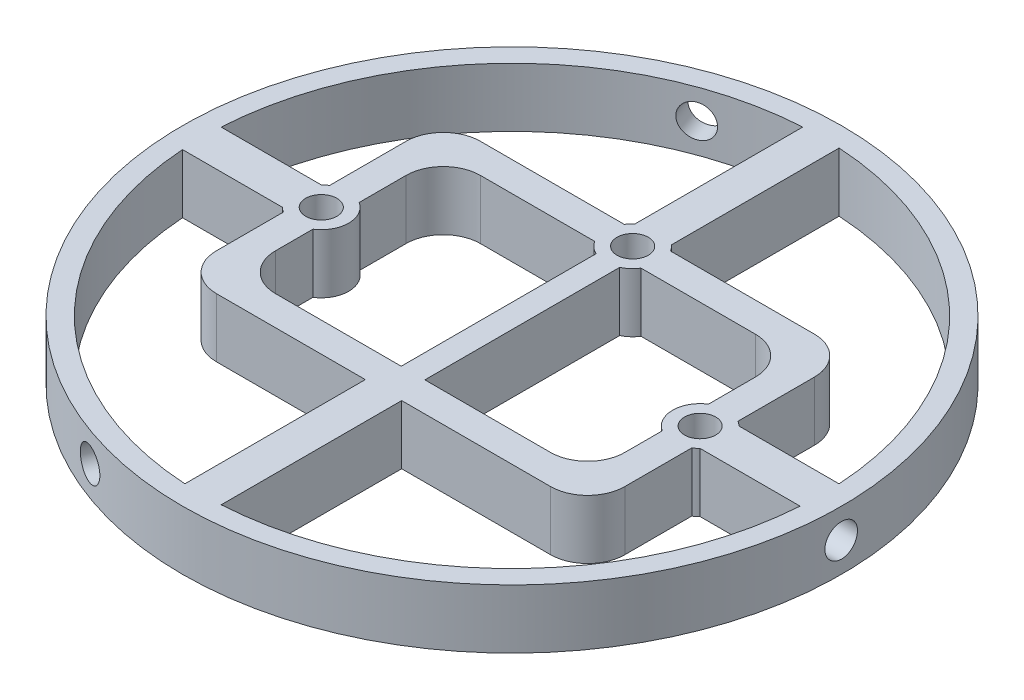
from build123d import *
from build123d.topology import SkipClean

# Parameters (mm, degrees)
SKETCH1_R                       = 37.719
BOSS_EXTRUDE2_DEPTH             = 6.35
SKETCH2_R                       = 1.68021
CUT_EXTRUDE1_DEPTH              = 6.35
CUT_EXTRUDE5_START              = -10
CUT_EXTRUDE5_DEPTH              = 10
BOSS_EXTRUDE3_DEPTH             = 6.35
BOSS_EXTRUDE4_START             = -6.35
BOSS_EXTRUDE4_DEPTH             = 6.35
CIRPATTERN3_COUNT               = 2
CIRPATTERN3_ANGLE               = 70
SKETCH13_R                      = 1.7526
CUT_EXTRUDE7_DEPTH              = 6.35
CIRPATTERN4_COUNT               = 2
CIRPATTERN4_ANGLE               = 140
CUT_EXTRUDE8_START              = -10.414
CUT_EXTRUDE8_DEPTH              = 10.414
CUT_EXTRUDE9_START              = 50.8
SKETCH16_R                      = 1.7526
CUT_EXTRUDE9_DEPTH              = 21.59
SKETCH17_R                      = 58.380414481
SKETCH17_R_2                    = 35.433
CUT_EXTRUDE10_DEPTH             = 18.796
BOSS_EXTRUDE5_START             = -6.35
SKETCH18_R                      = 34.941086643
SKETCH18_R_2                    = 33.274
BOSS_EXTRUDE5_DEPTH             = 6.35
CUT_EXTRUDE11_START             = 50.8
SKETCH19_R                      = 1.7526
CUT_EXTRUDE11_DEPTH             = 22.86
CIRPATTERN6_COUNT               = 2
CIRPATTERN6_ANGLE               = 110
CIRPATTERN6_THE_OTHER_WAY_COUNT = 2
CIRPATTERN6_THE_OTHER_WAY_ANGLE = 110
CIRPATTERN7_COUNT               = 2


with BuildPart() as part:
    # Sketch1 → Boss-Extrude2 (new body)
    # profile 1 of 2: a face of its own
    with BuildSketch(Plane(origin=(0, 0, 0), x_dir=(1, 0, 0), z_dir=(0, 1, 0))):
        with Locations(Location((0, 0, 0), (0, 0, 270))):
            Circle(SKETCH1_R)
        with BuildLine():
            ThreePointArc((-34.011603621, -4.360609948), (-34.289708145, -0.141475536), (-34.046427859, 4.079810052))
            ThreePointArc((-34.046427859, 4.079810052), (-24.295799022, 24.197484371), (-4.217826514, 34.029605339))
            ThreePointArc((-4.217826514, 34.029605339), (0, 34.29), (4.217826514, 34.029605339))
            ThreePointArc((4.217826514, 34.029605339), (24.295799022, 24.197484371), (34.046427859, 4.079810052))
            ThreePointArc((34.046427859, 4.079810052), (34.229052801, 2.043537218), (34.29, 0))
            ThreePointArc((34.29, 0), (34.220330128, -2.184743902), (34.011603621, -4.360609948))
            ThreePointArc((34.011603621, -4.360609948), (24.195756942, -24.297519339), (4.217826514, -34.029605339))
            ThreePointArc((4.217826514, -34.029605339), (0, -34.29), (-4.217826514, -34.029605339))
            ThreePointArc((-4.217826514, -34.029605339), (-24.195756942, -24.297519339), (-34.011603621, -4.360609948))
        make_face(mode=Mode.SUBTRACT)
    # profile 2 of 2: a face of its own
    with BuildSketch(Plane(origin=(0, 0, 0), x_dir=(1, 0, 0), z_dir=(0, 1, 0))):
        with BuildLine():
            Line((-23.22349651, 10.122441588), (-23.22349651, 4.079810052))
            Line((-23.22349651, 4.079810052), (-34.046427859, 4.079810052))
            ThreePointArc((-34.046427859, 4.079810052), (-34.289708145, -0.141475536), (-34.011603621, -4.360609948))
            Line((-34.011603621, -4.360609948), (-23.22349651, -4.360609948))
            Line((-23.22349651, -4.360609948), (-23.22349651, -10.403241484))
            ThreePointArc((-23.22349651, -10.403241484), (-21.759030416, -13.93877539), (-18.22349651, -15.403241484))
            Line((-18.22349651, -15.403241484), (-4.217826514, -15.403241484))
            Line((-4.217826514, -15.403241484), (-4.217826514, -34.029605339))
            ThreePointArc((-4.217826514, -34.029605339), (0, -34.29), (4.217826514, -34.029605339))
            Line((4.217826514, -34.029605339), (4.217826514, -15.403241484))
            Line((4.217826514, -15.403241484), (18.22349651, -15.403241484))
            ThreePointArc((18.22349651, -15.403241484), (21.759030416, -13.93877539), (23.22349651, -10.403241484))
            Line((23.22349651, -10.403241484), (23.22349651, -4.360609948))
            Line((23.22349651, -4.360609948), (34.011603621, -4.360609948))
            ThreePointArc((34.011603621, -4.360609948), (34.220330128, -2.184743902), (34.29, 0))
            ThreePointArc((34.29, 0), (34.229052801, 2.043537218), (34.046427859, 4.079810052))
            Line((34.046427859, 4.079810052), (23.22349651, 4.079810052))
            Line((23.22349651, 4.079810052), (23.22349651, 10.122441588))
            ThreePointArc((23.22349651, 10.122441588), (21.759030416, 13.657975493), (18.22349651, 15.122441588))
            Line((18.22349651, 15.122441588), (4.217826514, 15.122441588))
            Line((4.217826514, 15.122441588), (4.217826514, 34.029605339))
            ThreePointArc((4.217826514, 34.029605339), (0, 34.29), (-4.217826514, 34.029605339))
            Line((-4.217826514, 34.029605339), (-4.217826514, 15.122441588))
            Line((-4.217826514, 15.122441588), (-18.22349651, 15.122441588))
            ThreePointArc((-18.22349651, 15.122441588), (-21.759030416, 13.657975493), (-23.22349651, 10.122441588))
        make_face()
        with BuildLine():
            Line((-14.87349651, 8.772441588), (-4.217826514, 8.772441588))
            Line((-4.217826514, 8.772441588), (-4.217826514, -9.053241484))
            Line((-4.217826514, -9.053241484), (-14.87349651, -9.053241484))
            ThreePointArc((-14.87349651, -9.053241484), (-16.287710073, -8.467455047), (-16.87349651, -7.053241484))
            Line((-16.87349651, -7.053241484), (-16.87349651, -4.360609948))
            Line((-16.87349651, -4.360609948), (-16.87349651, 4.079810052))
            Line((-16.87349651, 4.079810052), (-16.87349651, 6.772441588))
            ThreePointArc((-16.87349651, 6.772441588), (-16.287710073, 8.18665515), (-14.87349651, 8.772441588))
        make_face(mode=Mode.SUBTRACT)
        with BuildLine():
            Line((16.87349651, 4.079810052), (16.87349651, -4.360609948))
            Line((16.87349651, -4.360609948), (16.87349651, -7.053241484))
            ThreePointArc((16.87349651, -7.053241484), (16.287710073, -8.467455047), (14.87349651, -9.053241484))
            Line((14.87349651, -9.053241484), (4.217826514, -9.053241484))
            Line((4.217826514, -9.053241484), (4.217826514, 8.772441588))
            Line((4.217826514, 8.772441588), (14.87349651, 8.772441588))
            ThreePointArc((14.87349651, 8.772441588), (16.287710073, 8.18665515), (16.87349651, 6.772441588))
            Line((16.87349651, 6.772441588), (16.87349651, 4.079810052))
        make_face(mode=Mode.SUBTRACT)
    extrude(amount=BOSS_EXTRUDE2_DEPTH)

    # Sketch2 → Cut-Extrude1 (cut)
    with BuildSketch(Plane(origin=(0, 6.35, 0), x_dir=(1, 0, 0), z_dir=(0, 1, 0))):
        with Locations(Location((-20.36599651, -0.140399948, 0), (0, 0, 270))):
            Circle(SKETCH2_R)
        with Locations(Location((0, 12.972585267, 0), (0, 0, 270))):
            Circle(SKETCH2_R)
        with Locations(Location((20.36599651, -0.140399948, 0), (0, 0, 270))):
            Circle(SKETCH2_R)
    extrude(amount=-CUT_EXTRUDE1_DEPTH, mode=Mode.SUBTRACT)

    # Sketch7 → Cut-Extrude5 (cut)
    # profile 1 of 6: a face of its own
    with SkipClean():  # the faces are left unmerged after this step: merging them gives an invalid solid
        with BuildSketch(Plane(origin=(0, 6.35, 0), x_dir=(1, 0, 0), z_dir=(0, 1, 0)).offset(CUT_EXTRUDE5_START)):
            with BuildLine():
                Line((-2.95021, 14.560085267), (-2.48668108, 14.560085267))
                ThreePointArc((-2.48668108, 14.560085267), (-1.953782114, 15.183122418), (-1.27, 15.635448209))
                Line((-1.27, 15.635448209), (-1.27, 34.266473411))
                ThreePointArc((-1.27, 34.266473411), (-2.74646802, 34.179833432), (-4.217826514, 34.029605339))
                Line((-4.217826514, 34.029605339), (-4.217826514, 15.122441588))
                Line((-4.217826514, 15.122441588), (-18.22349651, 15.122441588))
                ThreePointArc((-18.22349651, 15.122441588), (-21.759030416, 13.657975493), (-23.22349651, 10.122441588))
                Line((-23.22349651, 10.122441588), (-23.22349651, 4.079810052))
                Line((-23.22349651, 4.079810052), (-34.046427859, 4.079810052))
                ThreePointArc((-34.046427859, 4.079810052), (-34.178298252, 2.765506927), (-34.259451272, 1.447100052))
                Line((-34.259451272, 1.447100052), (-22.85267759, 1.447100052))
                ThreePointArc((-22.85267759, 1.447100052), (-22.452110007, 1.945713548), (-21.95349651, 2.346281132))
                Line((-21.95349651, 2.346281132), (-21.95349651, 10.560085267))
                ThreePointArc((-21.95349651, 10.560085267), (-20.781923635, 13.388512392), (-17.95349651, 14.560085267))
                Line((-17.95349651, 14.560085267), (-2.95021, 14.560085267))
            make_face()
        # profile 2 of 6: a face of its own
        with BuildSketch(Plane(origin=(0, 6.35, 0), x_dir=(1, 0, 0), z_dir=(0, 1, 0)).offset(CUT_EXTRUDE5_START)):
            with BuildLine():
                Line((21.95349651, 10.560085267), (21.95349651, 2.346281132))
                ThreePointArc((21.95349651, 2.346281132), (22.452110007, 1.945713548), (22.85267759, 1.447100052))
                Line((22.85267759, 1.447100052), (34.259451272, 1.447100052))
                ThreePointArc((34.259451272, 1.447100052), (34.178298252, 2.765506927), (34.046427859, 4.079810052))
                Line((34.046427859, 4.079810052), (23.22349651, 4.079810052))
                Line((23.22349651, 4.079810052), (23.22349651, 10.122441588))
                ThreePointArc((23.22349651, 10.122441588), (21.759030416, 13.657975493), (18.22349651, 15.122441588))
                Line((18.22349651, 15.122441588), (4.217826514, 15.122441588))
                Line((4.217826514, 15.122441588), (4.217826514, 34.029605339))
                ThreePointArc((4.217826514, 34.029605339), (2.74646802, 34.179833432), (1.27, 34.266473411))
                Line((1.27, 34.266473411), (1.27, 15.635448209))
                ThreePointArc((1.27, 15.635448209), (1.953782114, 15.183122418), (2.48668108, 14.560085267))
                Line((2.48668108, 14.560085267), (17.95349651, 14.560085267))
                ThreePointArc((17.95349651, 14.560085267), (20.781923635, 13.388512392), (21.95349651, 10.560085267))
            make_face()
        # profile 3 of 6: a face of its own
        with BuildSketch(Plane(origin=(0, 6.35, 0), x_dir=(1, 0, 0), z_dir=(0, 1, 0)).offset(CUT_EXTRUDE5_START)):
            with BuildLine():
                ThreePointArc((22.85267759, -1.727899948), (22.452110007, -2.226513445), (21.95349651, -2.627081029))
                Line((21.95349651, -2.627081029), (21.95349651, -9.815741484))
                ThreePointArc((21.95349651, -9.815741484), (20.781923635, -12.644168609), (17.95349651, -13.815741484))
                Line((17.95349651, -13.815741484), (4.217826514, -13.815741484))
                Line((4.217826514, -13.815741484), (1.27, -13.815741484))
                Line((1.27, -13.815741484), (1.27, -34.266473411))
                ThreePointArc((1.27, -34.266473411), (2.74646802, -34.179833432), (4.217826514, -34.029605339))
                Line((4.217826514, -34.029605339), (4.217826514, -15.403241484))
                Line((4.217826514, -15.403241484), (18.22349651, -15.403241484))
                ThreePointArc((18.22349651, -15.403241484), (21.759030416, -13.93877539), (23.22349651, -10.403241484))
                Line((23.22349651, -10.403241484), (23.22349651, -4.360609948))
                Line((23.22349651, -4.360609948), (34.011603621, -4.360609948))
                ThreePointArc((34.011603621, -4.360609948), (34.154396863, -3.046518488), (34.246437213, -1.727899948))
                Line((34.246437213, -1.727899948), (22.85267759, -1.727899948))
            make_face()
        # profile 4 of 6: a face of its own
        with BuildSketch(Plane(origin=(0, 6.35, 0), x_dir=(1, 0, 0), z_dir=(0, 1, 0)).offset(CUT_EXTRUDE5_START)):
            with BuildLine():
                Line((-1.27, -34.266473411), (-1.27, -13.815741484))
                Line((-1.27, -13.815741484), (-17.95349651, -13.815741484))
                ThreePointArc((-17.95349651, -13.815741484), (-20.781923635, -12.644168609), (-21.95349651, -9.815741484))
                Line((-21.95349651, -9.815741484), (-21.95349651, -2.627081029))
                ThreePointArc((-21.95349651, -2.627081029), (-22.452110007, -2.226513445), (-22.85267759, -1.727899948))
                Line((-22.85267759, -1.727899948), (-34.246437213, -1.727899948))
                ThreePointArc((-34.246437213, -1.727899948), (-34.154396863, -3.046518488), (-34.011603621, -4.360609948))
                Line((-34.011603621, -4.360609948), (-23.22349651, -4.360609948))
                Line((-23.22349651, -4.360609948), (-23.22349651, -10.403241484))
                ThreePointArc((-23.22349651, -10.403241484), (-21.759030416, -13.93877539), (-18.22349651, -15.403241484))
                Line((-18.22349651, -15.403241484), (-4.217826514, -15.403241484))
                Line((-4.217826514, -15.403241484), (-4.217826514, -34.029605339))
                ThreePointArc((-4.217826514, -34.029605339), (-2.74646802, -34.179833432), (-1.27, -34.266473411))
            make_face()
        # profile 5 of 6: a face of its own
        with BuildSketch(Plane(origin=(0, 6.35, 0), x_dir=(1, 0, 0), z_dir=(0, 1, 0)).offset(CUT_EXTRUDE5_START)):
            with BuildLine():
                Line((-1.27, -10.640741484), (-1.27, 10.309722326))
                ThreePointArc((-1.27, 10.309722326), (-1.953782114, 10.762048116), (-2.48668108, 11.385085267))
                Line((-2.48668108, 11.385085267), (-2.95021, 11.385085267))
                Line((-2.95021, 11.385085267), (-14.77849651, 11.385085267))
                ThreePointArc((-14.77849651, 11.385085267), (-17.606923635, 10.213512392), (-18.77849651, 7.385085267))
                Line((-18.77849651, 7.385085267), (-18.77849651, 2.346281132))
                ThreePointArc((-18.77849651, 2.346281132), (-17.778797502, 1.277394231), (-17.41578651, -0.140399948))
                ThreePointArc((-17.41578651, -0.140399948), (-17.778797502, -1.558194128), (-18.77849651, -2.627081029))
                Line((-18.77849651, -2.627081029), (-18.77849651, -6.640741484))
                ThreePointArc((-18.77849651, -6.640741484), (-17.606923635, -9.469168609), (-14.77849651, -10.640741484))
                Line((-14.77849651, -10.640741484), (-1.27, -10.640741484))
            make_face()
            with BuildLine():
                Line((-4.217826514, -9.053241484), (-14.87349651, -9.053241484))
                ThreePointArc((-14.87349651, -9.053241484), (-16.287710073, -8.467455047), (-16.87349651, -7.053241484))
                Line((-16.87349651, -7.053241484), (-16.87349651, 6.772441588))
                ThreePointArc((-16.87349651, 6.772441588), (-16.287710073, 8.18665515), (-14.87349651, 8.772441588))
                Line((-14.87349651, 8.772441588), (-4.217826514, 8.772441588))
                Line((-4.217826514, 8.772441588), (-4.217826514, -9.053241484))
            make_face(mode=Mode.SUBTRACT)
        # profile 6 of 6: a face of its own
        with BuildSketch(Plane(origin=(0, 6.35, 0), x_dir=(1, 0, 0), z_dir=(0, 1, 0)).offset(CUT_EXTRUDE5_START)):
            with BuildLine():
                Line((18.77849651, 2.346281132), (18.77849651, 7.385085267))
                ThreePointArc((18.77849651, 7.385085267), (17.606923635, 10.213512392), (14.77849651, 11.385085267))
                Line((14.77849651, 11.385085267), (2.48668108, 11.385085267))
                ThreePointArc((2.48668108, 11.385085267), (1.953782114, 10.762048116), (1.27, 10.309722326))
                Line((1.27, 10.309722326), (1.27, -10.640741484))
                Line((1.27, -10.640741484), (4.217826514, -10.640741484))
                Line((4.217826514, -10.640741484), (14.77849651, -10.640741484))
                ThreePointArc((14.77849651, -10.640741484), (17.606923635, -9.469168609), (18.77849651, -6.640741484))
                Line((18.77849651, -6.640741484), (18.77849651, -2.627081029))
                ThreePointArc((18.77849651, -2.627081029), (17.41578651, -0.140399948), (18.77849651, 2.346281132))
            make_face()
            with BuildLine():
                Line((4.217826514, 8.772441588), (14.87349651, 8.772441588))
                ThreePointArc((14.87349651, 8.772441588), (16.287710073, 8.18665515), (16.87349651, 6.772441588))
                Line((16.87349651, 6.772441588), (16.87349651, -7.053241484))
                ThreePointArc((16.87349651, -7.053241484), (16.287710073, -8.467455047), (14.87349651, -9.053241484))
                Line((14.87349651, -9.053241484), (4.217826514, -9.053241484))
                Line((4.217826514, -9.053241484), (4.217826514, 8.772441588))
            make_face(mode=Mode.SUBTRACT)
        extrude(amount=CUT_EXTRUDE5_DEPTH, mode=Mode.SUBTRACT)

    # Sketch8 → Boss-Extrude3 (add)
    with SkipClean():  # the faces are left unmerged after this step: merging them gives an invalid solid
        with BuildSketch(Plane.XZ):
            with BuildLine():
                ThreePointArc((-34.155457873, -3.034600052), (-34.28971008, 0.141005708), (-34.129345484, 3.315399948))
                Line((-34.129345484, 3.315399948), (-37.318016402, 3.315399948))
                ThreePointArc((-37.318016402, 3.315399948), (-37.464735022, 0.140906853), (-37.341899088, -3.034600052))
                Line((-37.341899088, -3.034600052), (-34.155457873, -3.034600052))
            make_face()
            with BuildLine():
                Line((-37.318016402, 3.315399948), (-34.129345484, 3.315399948))
                ThreePointArc((-34.129345484, 3.315399948), (1.659645044, 34.249812822), (34.29, 0))
                ThreePointArc((34.29, 0), (1.51879056, -34.256347955), (-34.155457873, -3.034600052))
                Line((-34.155457873, -3.034600052), (-37.341899088, -3.034600052))
                ThreePointArc((-37.341899088, -3.034600052), (1.518547934, -37.434212122), (37.465, 0))
                ThreePointArc((37.465, 0), (1.659328252, 37.428236063), (-37.318016402, 3.315399948))
            make_face()
        boss_extrude3 = extrude(amount=-BOSS_EXTRUDE3_DEPTH)

    # Sketch10 → Boss-Extrude4 (add)
    with SkipClean():  # the faces are left unmerged after this step: merging them gives an invalid solid
        with BuildSketch(Plane(origin=(0, 6.35, 0), x_dir=(1, 0, 0), z_dir=(0, 1, 0)).offset(BOSS_EXTRUDE4_START)):
            with BuildLine():
                ThreePointArc((1.27, 15.635448209), (1.627680077, 15.433153618), (1.953782114, 15.183122418))
                Line((1.953782114, 15.183122418), (1.953782114, 34.234293266))
                ThreePointArc((1.953782114, 34.234293266), (1.611971361, 34.252089693), (1.27, 34.266473411))
                Line((1.27, 34.266473411), (1.27, 15.635448209))
            make_face()
            with BuildLine():
                Line((-1.953782114, 34.234293266), (-1.953782114, 15.183122418))
                ThreePointArc((-1.953782114, 15.183122418), (-1.627680077, 15.433153618), (-1.27, 15.635448209))
                Line((-1.27, 15.635448209), (-1.27, 34.266473411))
                ThreePointArc((-1.27, 34.266473411), (-1.611971361, 34.252089693), (-1.953782114, 34.234293266))
            make_face()
            with BuildLine():
                ThreePointArc((34.259451272, 1.447100052), (34.248009453, 1.696451748), (34.234752793, 1.945713548))
                Line((34.234752793, 1.945713548), (22.452110007, 1.945713548))
                ThreePointArc((22.452110007, 1.945713548), (22.66594573, 1.707293919), (22.85267759, 1.447100052))
                Line((22.85267759, 1.447100052), (34.259451272, 1.447100052))
            make_face()
            with BuildLine():
                Line((-22.452110007, 1.945713548), (-34.234752793, 1.945713548))
                ThreePointArc((-34.234752793, 1.945713548), (-34.248009453, 1.696451748), (-34.259451272, 1.447100052))
                Line((-34.259451272, 1.447100052), (-22.85267759, 1.447100052))
                ThreePointArc((-22.85267759, 1.447100052), (-22.66594573, 1.707293919), (-22.452110007, 1.945713548))
            make_face()
            with BuildLine():
                ThreePointArc((22.85267759, -1.727899948), (22.66594573, -1.988093816), (22.452110007, -2.226513445))
                Line((22.452110007, -2.226513445), (34.217637818, -2.226513445))
                ThreePointArc((34.217637818, -2.226513445), (34.232945335, -1.977259132), (34.246437213, -1.727899948))
                Line((34.246437213, -1.727899948), (22.85267759, -1.727899948))
            make_face()
            with BuildLine():
                Line((-34.217637818, -2.226513445), (-22.452110007, -2.226513445))
                ThreePointArc((-22.452110007, -2.226513445), (-22.66594573, -1.988093816), (-22.85267759, -1.727899948))
                Line((-22.85267759, -1.727899948), (-34.246437213, -1.727899948))
                ThreePointArc((-34.246437213, -1.727899948), (-34.232945335, -1.977259132), (-34.217637818, -2.226513445))
            make_face()
            with BuildLine():
                Line((1.953782114, -34.234293266), (1.953782114, -13.815741484))
                Line((1.953782114, -13.815741484), (1.27, -13.815741484))
                Line((1.27, -13.815741484), (1.27, -34.266473411))
                ThreePointArc((1.27, -34.266473411), (1.611971361, -34.252089693), (1.953782114, -34.234293266))
            make_face()
            with BuildLine():
                Line((-1.27, -13.815741484), (-1.953782114, -13.815741484))
                Line((-1.953782114, -13.815741484), (-1.953782114, -34.234293266))
                ThreePointArc((-1.953782114, -34.234293266), (-1.611971361, -34.252089693), (-1.27, -34.266473411))
                Line((-1.27, -34.266473411), (-1.27, -13.815741484))
            make_face()
        extrude(amount=BOSS_EXTRUDE4_DEPTH)

    # CirPattern3: Boss-Extrude3 ×2 about axis
    with SkipClean():  # the faces are left unmerged after this step: merging them gives an invalid solid
        cirpattern3_axis = Axis((0, 0, 0), (0, -1, 0))
        for i in range(1, CIRPATTERN3_COUNT):
            add(boss_extrude3.rotate(cirpattern3_axis, i * CIRPATTERN3_ANGLE / (CIRPATTERN3_COUNT - 1)))

    # Sketch13 → Cut-Extrude7 (cut)
    with SkipClean():  # the faces are left unmerged after this step: merging them gives an invalid solid
        with BuildSketch(Plane(origin=(-12.900657786, 6.35, -35.444265963), x_dir=(-0.9396926207859082, 0, 0.34202014332566943), z_dir=(-0.34202014332566943, 0, -0.9396926207859082))):
            with Locations((0, -3.175)):
                Circle(SKETCH13_R)
        cut_extrude7 = extrude(amount=-CUT_EXTRUDE7_DEPTH, mode=Mode.SUBTRACT)

    # CirPattern4: Cut-Extrude7 ×2 about axis
    with SkipClean():  # the faces are left unmerged after this step: merging them gives an invalid solid
        cirpattern4_axis = Axis((0, 0, 0), (0, 1, 0))
        for i in range(1, CIRPATTERN4_COUNT):
            add(cut_extrude7.rotate(cirpattern4_axis, i * CIRPATTERN4_ANGLE / (CIRPATTERN4_COUNT - 1)), mode=Mode.SUBTRACT)

    # Sketch14 → Cut-Extrude8 (cut)
    with BuildSketch(Plane(origin=(0, 6.35, 0), x_dir=(1, 0, 0), z_dir=(0, 1, 0)).offset(CUT_EXTRUDE8_START)):
        with BuildLine():
            Line((-34.886870518, 1.945713548), (-34.234752793, 1.945713548))
            ThreePointArc((-34.234752793, 1.945713548), (-24.24954865, 24.243834067), (-1.953782114, 34.234293266))
            Line((-1.953782114, 34.234293266), (-1.953782114, 34.886419582))
            ThreePointArc((-1.953782114, 34.886419582), (-24.709936262, 24.704222022), (-34.886870518, 1.945713548))
        make_face()
        with BuildLine():
            Line((1.953782114, 34.886419582), (1.953782114, 34.234293266))
            ThreePointArc((1.953782114, 34.234293266), (24.24954865, 24.243834067), (34.234752793, 1.945713548))
            Line((34.234752793, 1.945713548), (34.886870518, 1.945713548))
            ThreePointArc((34.886870518, 1.945713548), (24.709936262, 24.704222022), (1.953782114, 34.886419582))
        make_face()
        with BuildLine():
            ThreePointArc((34.217637818, -2.226513445), (24.149894353, -24.343103803), (1.953782114, -34.234293266))
            Line((1.953782114, -34.234293266), (1.953782114, -34.886419582))
            ThreePointArc((1.953782114, -34.886419582), (24.610292395, -24.803488545), (34.870075619, -2.226513445))
            Line((34.870075619, -2.226513445), (34.217637818, -2.226513445))
        make_face()
        with BuildLine():
            ThreePointArc((-1.953782114, -34.234293266), (-24.149894353, -24.343103803), (-34.217637818, -2.226513445))
            Line((-34.217637818, -2.226513445), (-34.870075619, -2.226513445))
            ThreePointArc((-34.870075619, -2.226513445), (-24.610292395, -24.803488545), (-1.953782114, -34.886419582))
            Line((-1.953782114, -34.886419582), (-1.953782114, -34.234293266))
        make_face()
    extrude(amount=CUT_EXTRUDE8_DEPTH, mode=Mode.SUBTRACT)

    # Sketch16 → Cut-Extrude9 (cut)
    with BuildSketch(Plane(origin=(0, 0, 0), x_dir=(0, 0, -1), z_dir=(1, 0, 0)).offset(CUT_EXTRUDE9_START)):
        with Locations((0, 3.175)):
            Circle(SKETCH16_R)
    extrude(amount=-CUT_EXTRUDE9_DEPTH, mode=Mode.SUBTRACT)

    # Sketch17 → Cut-Extrude10 (cut)
    with BuildSketch(Plane(origin=(0, 6.35, 0), x_dir=(1, 0, 0), z_dir=(0, 1, 0))):
        Circle(SKETCH17_R)
        with Locations(Location((0, 0, 0), (0, 0, 270))):
            Circle(SKETCH17_R_2, mode=Mode.SUBTRACT)
    extrude(amount=-CUT_EXTRUDE10_DEPTH, mode=Mode.SUBTRACT)

    # Sketch18 → Boss-Extrude5 (add)
    with BuildSketch(Plane(origin=(0, 6.35, 0), x_dir=(1, 0, 0), z_dir=(0, 1, 0)).offset(BOSS_EXTRUDE5_START)):
        Circle(SKETCH18_R)
        Circle(SKETCH18_R_2, mode=Mode.SUBTRACT)
    extrude(amount=BOSS_EXTRUDE5_DEPTH)

    # Sketch19 → Cut-Extrude11 (cut)
    with BuildSketch(Plane(origin=(0, 0, 0), x_dir=(0, 0, -1), z_dir=(1, 0, 0)).offset(CUT_EXTRUDE11_START)):
        with Locations((0, 3.175)):
            Circle(SKETCH19_R)
    cut_extrude11 = extrude(amount=-CUT_EXTRUDE11_DEPTH, mode=Mode.SUBTRACT)

    # CirPattern6: Cut-Extrude11 ×2 about axis
    cirpattern6_axis = Axis((0, 0, 0), (0, 1, 0))
    for i in range(1, CIRPATTERN6_COUNT):
        add(cut_extrude11.rotate(cirpattern6_axis, i * CIRPATTERN6_ANGLE / (CIRPATTERN6_COUNT - 1)), mode=Mode.SUBTRACT)

    # CirPattern6 the other way: Cut-Extrude11 ×2 about axis
    cirpattern6_the_other_way_axis = Axis((0, 0, 0), (0, -1, 0))
    for i in range(1, CIRPATTERN6_THE_OTHER_WAY_COUNT):
        add(cut_extrude11.rotate(cirpattern6_the_other_way_axis, i * CIRPATTERN6_THE_OTHER_WAY_ANGLE / (CIRPATTERN6_THE_OTHER_WAY_COUNT - 1)), mode=Mode.SUBTRACT)

    # CirPattern7: Cut-Extrude11 ×2 about axis
    cirpattern7_axis = Axis((0, 0, 0), (0, 1, 0))
    for i in range(1, CIRPATTERN7_COUNT):
        add(cut_extrude11.rotate(cirpattern7_axis, i * 360 / CIRPATTERN7_COUNT), mode=Mode.SUBTRACT)


solid = part.part
